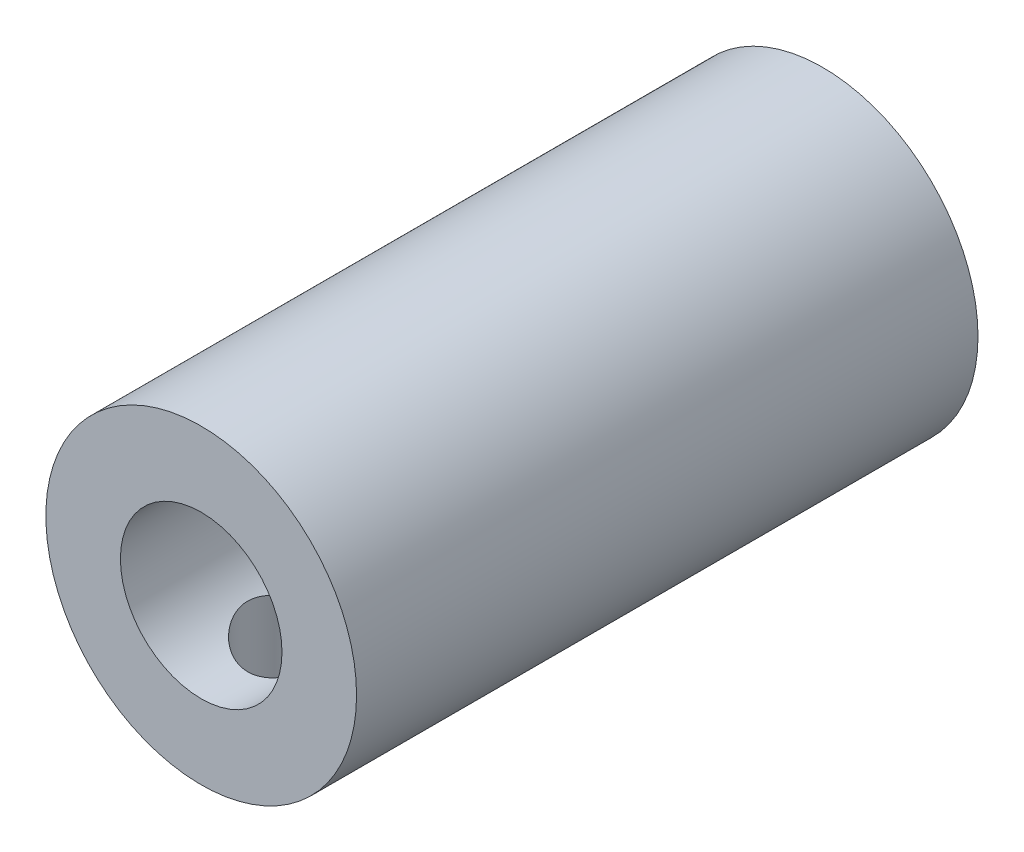
from build123d import *

# Parameters (mm, degrees)
SKETCH1_R           = 10
BOSS_EXTRUDE1_DEPTH = 20
SKETCH5_R           = 8
CUT_EXTRUDE2_DEPTH  = 25
SKETCH6_R           = 5.2
CUT_EXTRUDE3_DEPTH  = 25
SKETCH7_R           = 3
CUT_EXTRUDE4_DEPTH  = 10


with BuildPart() as part:
    # Sketch1 → Boss-Extrude1 (new, symmetric)
    with BuildSketch(Plane.XY):
        Circle(SKETCH1_R)
    extrude(amount=BOSS_EXTRUDE1_DEPTH, both=True)

    # Sketch5 → Cut-Extrude2 (cut)
    with BuildSketch(Plane.XY):
        Circle(SKETCH5_R)
    extrude(amount=-CUT_EXTRUDE2_DEPTH, mode=Mode.SUBTRACT)

    # Sketch6 → Cut-Extrude3 (cut)
    with BuildSketch(Plane.XY):
        Circle(SKETCH6_R)
    extrude(amount=CUT_EXTRUDE3_DEPTH, mode=Mode.SUBTRACT)

    # Sketch7 → Cut-Extrude4 (cut)
    with BuildSketch(Plane(origin=(0, 0, 0), x_dir=(1, 0, 0), z_dir=(0, 1, 0))):
        with Locations(Location((0, 14, 0), (0, 0, 270))):
            Circle(SKETCH7_R)
        with Locations(Location((0, -14, 0), (0, 0, 270))):
            Circle(SKETCH7_R)
    extrude(amount=-CUT_EXTRUDE4_DEPTH, mode=Mode.SUBTRACT)


solid = part.part
